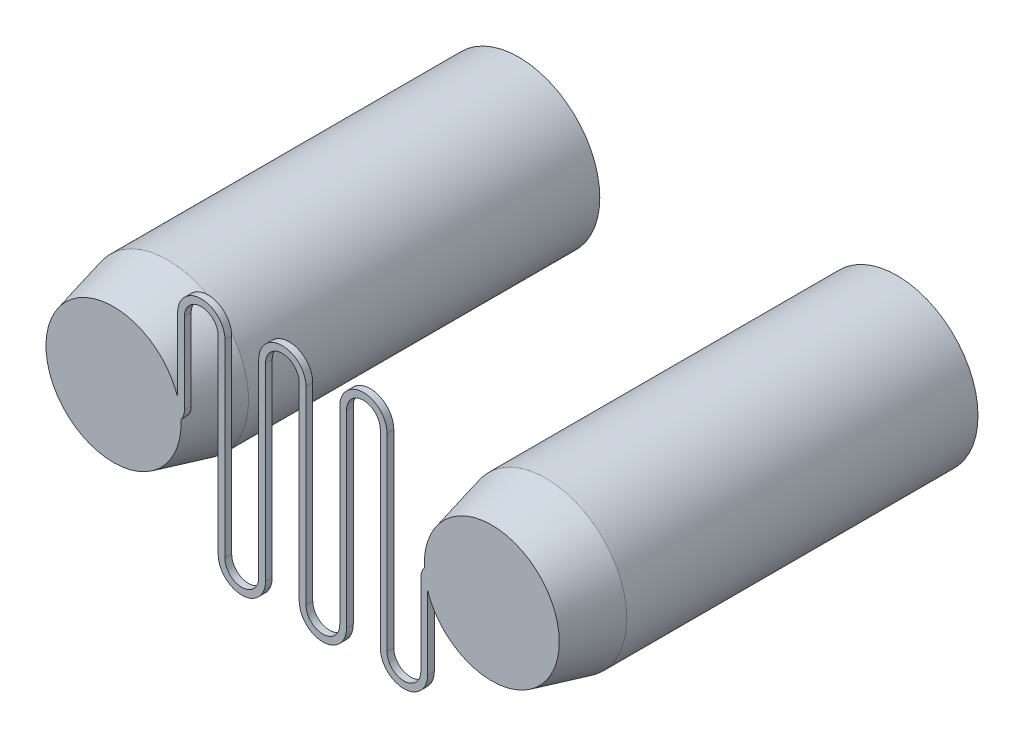
from build123d import *
from build123d.topology import SkipClean

# Parameters (mm, degrees)
BOSS_EXTRUDE1_DEPTH = 0.5
SKETCH5_R           = 5
CUT_EXTRUDE1_DEPTH  = 27


with BuildPart() as part:
    # Sketch2 → Boss-Extrude1 (new body)
    with BuildSketch(Plane.XY):
        with BuildLine():
            Line((-17.5, -0.25), (-13.5, -0.25))
            ThreePointArc((-13.5, -0.25), (-12.616116524, 0.116116524), (-12.25, 1))
            Line((-12.25, 1), (-12.25, 7))
            ThreePointArc((-12.25, 7), (-11, 8.25), (-9.75, 7))
            Line((-9.75, 7), (-9.75, 0))
            Line((-9.75, 0), (-9.75, -7))
            ThreePointArc((-9.75, -7), (-8, -8.75), (-6.25, -7))
            Line((-6.25, -7), (-6.25, 0))
            Line((-6.25, 0), (-6.25, 7))
            ThreePointArc((-6.25, 7), (-5, 8.25), (-3.75, 7))
            Line((-3.75, 7), (-3.75, 0))
            Line((-3.75, 0), (-3.75, -7))
            ThreePointArc((-3.75, -7), (-2, -8.75), (-0.25, -7))
            Line((-0.25, -7), (-0.25, 0))
            Line((-0.25, 0), (-0.25, 7))
            ThreePointArc((-0.25, 7), (1, 8.25), (2.25, 7))
            Line((2.25, 7), (2.25, 0))
            Line((2.25, 0), (2.25, -7))
            ThreePointArc((2.25, -7), (4, -8.75), (5.75, -7))
            Line((5.75, -7), (5.75, -1))
            ThreePointArc((5.75, -1), (5.969669914, -0.469669914), (6.5, -0.25))
            Line((6.5, -0.25), (10.5, -0.25))
            ThreePointArc((10.5, -0.25), (10.75, 0), (10.5, 0.25))
            Line((10.5, 0.25), (6.5, 0.25))
            ThreePointArc((6.5, 0.25), (5.616116524, -0.116116524), (5.25, -1))
            Line((5.25, -1), (5.25, -7))
            ThreePointArc((5.25, -7), (4, -8.25), (2.75, -7))
            Line((2.75, -7), (2.75, 0))
            Line((2.75, 0), (2.75, 7))
            ThreePointArc((2.75, 7), (1, 8.75), (-0.75, 7))
            Line((-0.75, 7), (-0.75, 0))
            Line((-0.75, 0), (-0.75, -7))
            ThreePointArc((-0.75, -7), (-2, -8.25), (-3.25, -7))
            Line((-3.25, -7), (-3.25, 0))
            Line((-3.25, 0), (-3.25, 7))
            ThreePointArc((-3.25, 7), (-5, 8.75), (-6.75, 7))
            Line((-6.75, 7), (-6.75, 0))
            Line((-6.75, 0), (-6.75, -7))
            ThreePointArc((-6.75, -7), (-8, -8.25), (-9.25, -7))
            Line((-9.25, -7), (-9.25, 0))
            Line((-9.25, 0), (-9.25, 7))
            ThreePointArc((-9.25, 7), (-11, 8.75), (-12.75, 7))
            Line((-12.75, 7), (-12.75, 1))
            ThreePointArc((-12.75, 1), (-12.969669914, 0.469669914), (-13.5, 0.25))
            Line((-13.5, 0.25), (-17.5, 0.25))
            ThreePointArc((-17.5, 0.25), (-17.75, 0), (-17.5, -0.25))
        make_face()
    extrude(amount=BOSS_EXTRUDE1_DEPTH)

    # Sketch3 → Revolve1 (revolve)
    with SkipClean():  # the faces are left unmerged after this step: merging them gives an invalid solid
        with BuildSketch(Plane(origin=(0, 0, 0), x_dir=(-1, 0, 0), z_dir=(0, -1, 0)), mode=Mode.PRIVATE) as revolve1_sk:
            Polygon((17.5, -0.5), (22.5, -0.5), (23.5, 3.5), (23.5, 29.5), (17.5, 29.5), align=None)
        revolve(revolve1_sk.sketch.rotate(Axis((-17.5, 0, 0.5), (0, 0, -1)), 157.945831956), axis=Axis((-17.5, 0, 0.5), (0, 0, -1)))

    # Sketch4 → Revolve2 (revolve)
    with SkipClean():  # the faces are left unmerged after this step: merging them gives an invalid solid
        with BuildSketch(Plane(origin=(0, 0, 0), x_dir=(-1, 0, 0), z_dir=(0, -1, 0)), mode=Mode.PRIVATE) as revolve2_sk:
            Polygon((-10.5, -0.5), (-15.5, -0.5), (-16.5, 3.5), (-16.5, 29.5), (-10.5, 29.5), align=None)
        revolve(revolve2_sk.sketch.rotate(Axis((10.5, 0, 0.5), (0, 0, -1)), 177.22310556), axis=Axis((10.5, 0, 0.5), (0, 0, -1)))

    # Sketch5 → Cut-Extrude1 (cut)
    with SkipClean():  # the faces are left unmerged after this step: merging them gives an invalid solid
        with BuildSketch(Plane(origin=(0, 0, -29.5), x_dir=(-1, 0, 0), z_dir=(0, 0, -1))):
            with Locations((-10.5, 0)):
                Circle(SKETCH5_R)
            with Locations((17.5, 0)):
                Circle(SKETCH5_R)
        extrude(amount=-CUT_EXTRUDE1_DEPTH, mode=Mode.SUBTRACT)


solid = part.part
